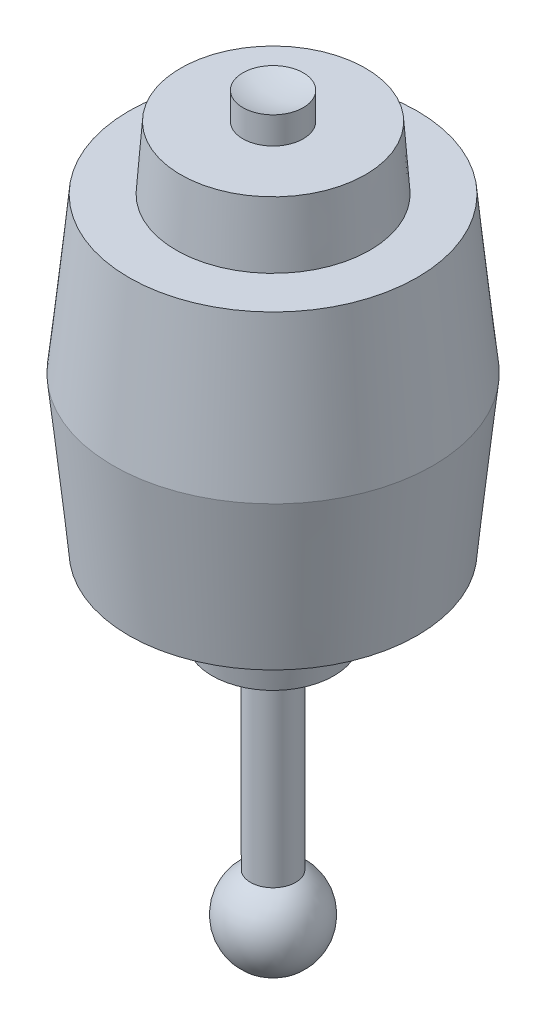
from build123d import *


with BuildPart() as part:
    # Sketch1 → Revolve1 (revolve)
    with BuildSketch(Plane.XY, mode=Mode.PRIVATE) as revolve1_sk:
        with BuildLine():
            Line((-2.5, -47.669872981), (-2.5, -25.7))
            Line((-2.5, -25.7), (-6.75, -25.7))
            Line((-6.75, -25.7), (-7.75, -17.2))
            Line((-7.75, -17.2), (-16, -17.2))
            Line((-16, -17.2), (-17.75, 0))
            Line((-17.75, 0), (-16, 17.2))
            Line((-16, 17.2), (-10.75, 17.2))
            Line((-10.75, 17.2), (-10.25, 24.2))
            Line((-10.25, 24.2), (-3.35, 24.2))
            Line((-3.35, 24.2), (-3.35, 27.2))
            ThreePointArc((-3.35, 27.2), (-1.699733397, 26.767694664), (0, 26.622181276))
            Line((0, 26.622181276), (0, -57))
            ThreePointArc((0, -57), (-4.829629131, -53.294095226), (-2.5, -47.669872981))
        make_face()
    revolve(revolve1_sk.sketch.rotate(Axis((0, -52, 0), (0, 1, 0)), 180), axis=Axis((0, -52, 0), (0, 1, 0)))


solid = part.part
